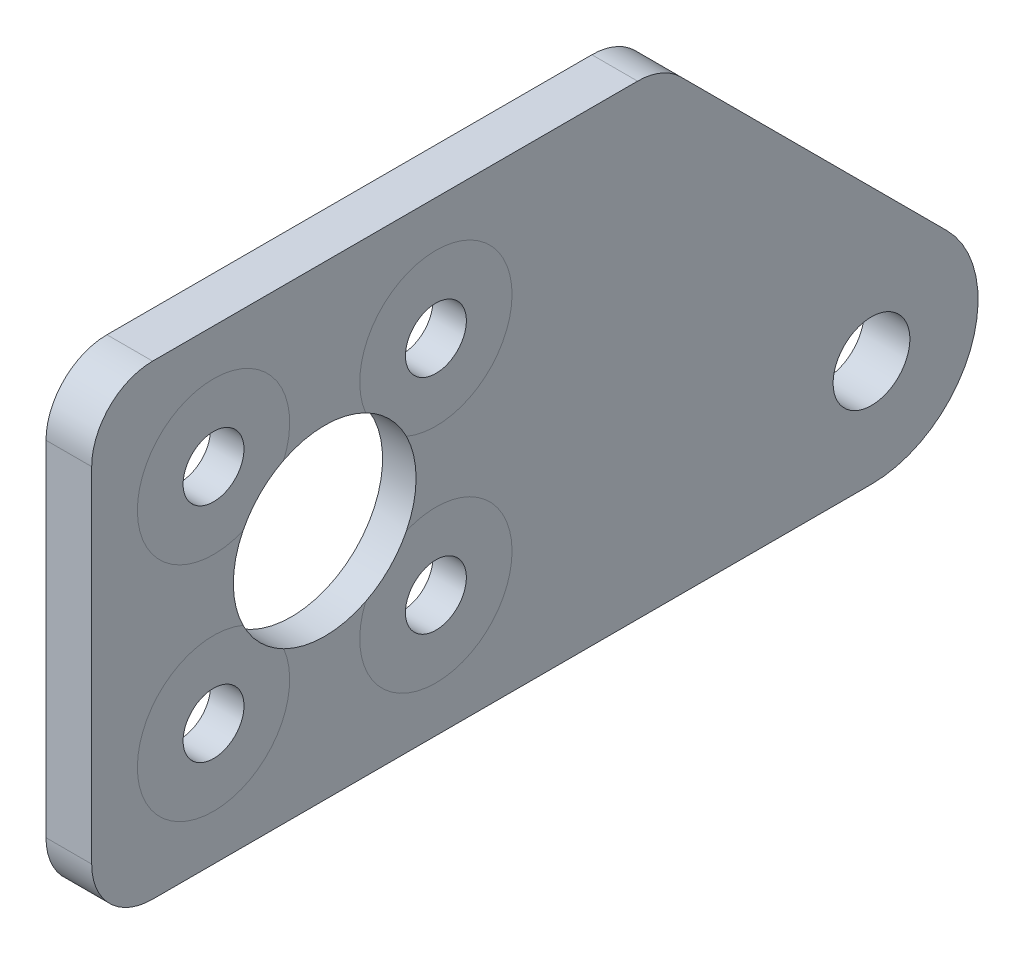
from build123d import *

# Parameters (mm, degrees)
SKETCH1_R           = 4.000000001
SKETCH1_R_2         = 3.175
SKETCH1_R_3         = 9.525
BOSS_EXTRUDE1_DEPTH = 4.7625
FILLET1_R           = 6.35
CUT_EXTRUDE4_DEPTH  = 1.27


with BuildPart() as part:
    # Sketch1 → Boss-Extrude1 (new body)
    with BuildSketch(Plane(origin=(0, 0, 0), x_dir=(0, 0, -1), z_dir=(1, 0, 0))):
        with BuildLine():
            Line((7.857724106, 7.857724106), (-21.748484988, 37.4639332))
            Line((-21.748484988, 37.4639332), (-81.276178769, 37.4639332))
            Line((-81.276178769, 37.4639332), (-81.276178769, -11.1125))
            Line((-81.276178769, -11.1125), (0, -11.1125))
            ThreePointArc((0, -11.1125), (10.266611305, -4.252569642), (7.857724106, 7.857724106))
        make_face()
        Circle(SKETCH1_R, mode=Mode.SUBTRACT)
        with Locations((-68.576178769, 24.7639332)):
            Circle(SKETCH1_R_2, mode=Mode.SUBTRACT)
        with Locations((-45.399745569, 24.7639332)):
            Circle(SKETCH1_R_2, mode=Mode.SUBTRACT)
        with Locations((-45.399745569, 1.5875)):
            Circle(SKETCH1_R_2, mode=Mode.SUBTRACT)
        with Locations((-68.576178769, 1.5875)):
            Circle(SKETCH1_R_2, mode=Mode.SUBTRACT)
        with Locations((-56.987962169, 13.1757166)):
            Circle(SKETCH1_R_3, mode=Mode.SUBTRACT)
    extrude(amount=BOSS_EXTRUDE1_DEPTH)

    # Fillet1
    fillet1_edges = [part.edges().sort_by_distance(p)[0] for p in [
        (2.38125, -11.1125, 81.276178769),
        (2.38125, 37.4639332, 21.748484988),
        (2.38125, 37.4639332, 81.276178769),
    ]]
    fillet(fillet1_edges, radius=FILLET1_R)

    # Sketch5 → Cut-Extrude4 (cut)
    with BuildSketch(Plane.ZY):
        with BuildLine():
            Line((35.620745569, 24.7639332), (35.620745569, 1.5875))
            ThreePointArc((35.620745569, 1.5875), (38.484948356, -5.327297213), (45.399745569, -8.1915))
            Line((45.399745569, -8.1915), (68.576178769, -8.1915))
            ThreePointArc((68.576178769, -8.1915), (75.490975982, -5.327297213), (78.355178769, 1.5875))
            Line((78.355178769, 1.5875), (78.355178769, 24.7639332))
            ThreePointArc((78.355178769, 24.7639332), (75.490975982, 31.678730413), (68.576178769, 34.5429332))
            Line((68.576178769, 34.5429332), (45.399745569, 34.5429332))
            ThreePointArc((45.399745569, 34.5429332), (38.484948356, 31.678730413), (35.620745569, 24.7639332))
        make_face()
    extrude(amount=-CUT_EXTRUDE4_DEPTH, mode=Mode.SUBTRACT)


solid = part.part
